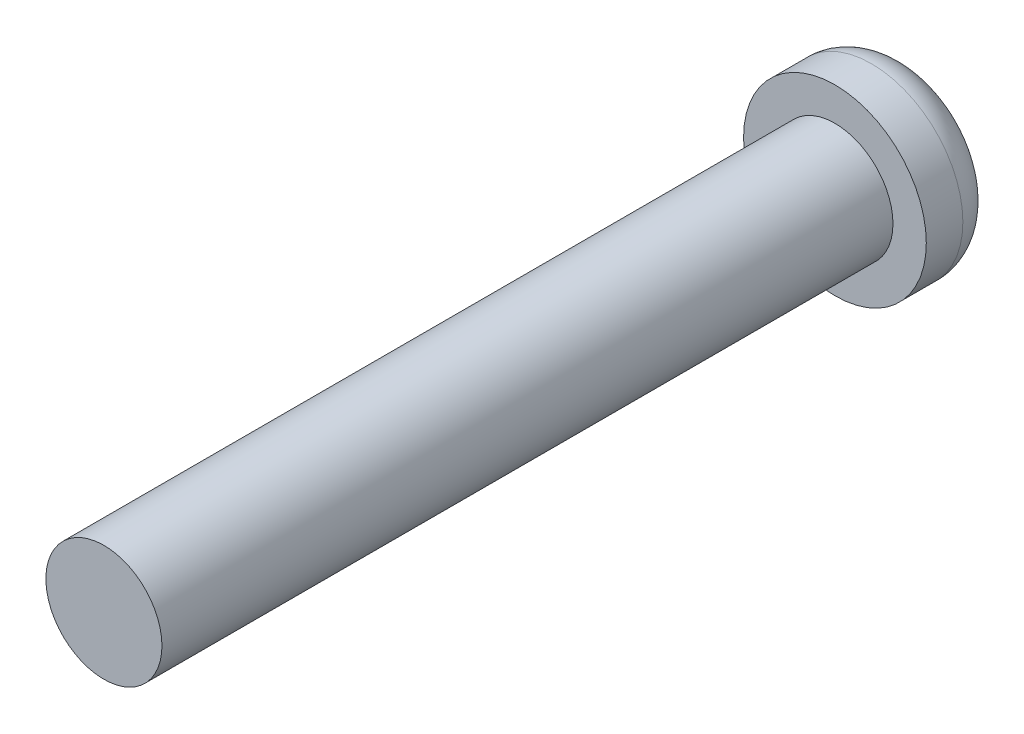
from build123d import *

# Parameters (mm, degrees)
CROQUIS1_R              = 1.5875
SALIENTE_EXTRUIR1_DEPTH = 20
CROQUIS2_R              = 2.5
SALIENTE_EXTRUIR2_DEPTH = 2
REDONDEO2_R             = 1


with BuildPart() as part:
    # Croquis1 → Saliente-Extruir1 (new body)
    with BuildSketch(Plane.XY):
        Circle(CROQUIS1_R)
    extrude(amount=SALIENTE_EXTRUIR1_DEPTH)

    # Croquis2 → Saliente-Extruir2 (add)
    with BuildSketch(Plane(origin=(0, 0, 0), x_dir=(-1, 0, 0), z_dir=(0, 0, -1))):
        Circle(CROQUIS2_R)
    extrude(amount=SALIENTE_EXTRUIR2_DEPTH)

    # Redondeo2
    redondeo2_edges = [part.edges().sort_by_distance(p)[0] for p in [
        (2.5, 0, -2),
    ]]
    fillet(redondeo2_edges, radius=REDONDEO2_R)


solid = part.part
